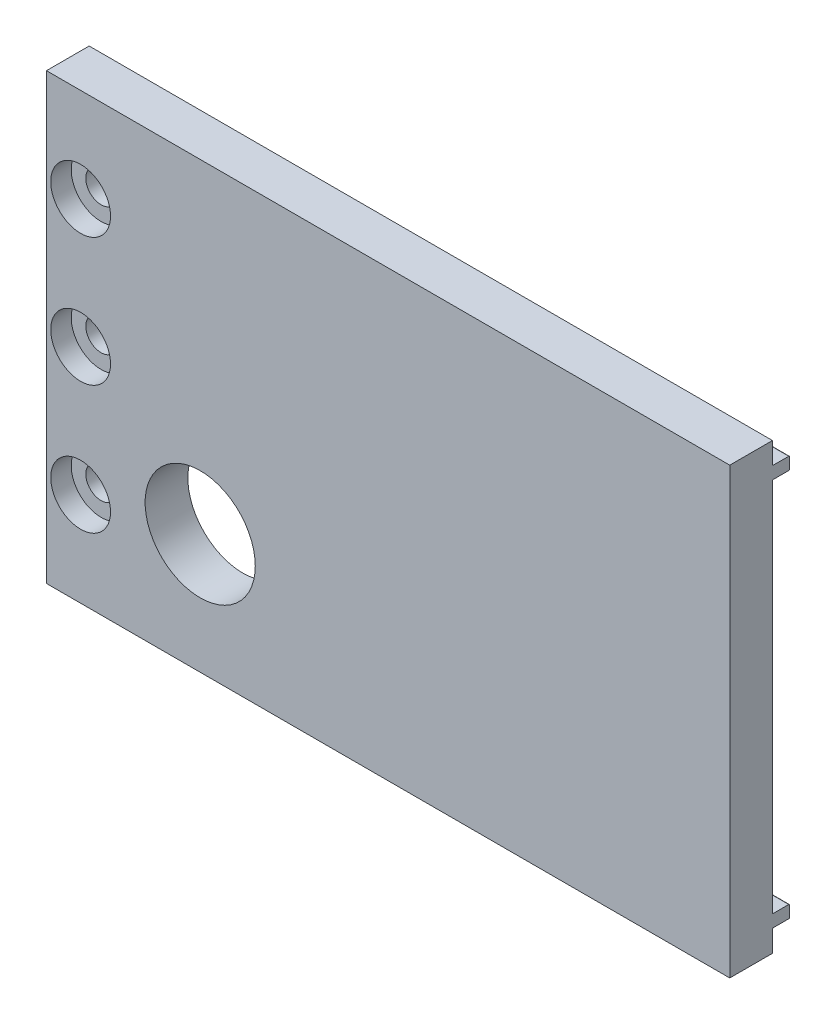
from build123d import *

# Parameters (mm, degrees)
ESQUISSE1_W                                        = 80
ESQUISSE1_H                                        = 52
BOSS_EXTRU_1_DEPTH                                 = 5
ESQUISSE2_R                                        = 6.447859464
ENL_V_MAT_EXTRU_1_DEPTH                            = 5
CHAMBRAGE_POUR_VIS_T_TE_RONDE_BOMB_E_M_D           = 3.6
CHAMBRAGE_POUR_VIS_T_TE_RONDE_BOMB_E_M_CBORE_D     = 7
CHAMBRAGE_POUR_VIS_T_TE_RONDE_BOMB_E_M_CBORE_DEPTH = 2.4
ESQUISSE5_W                                        = 72
ESQUISSE5_H                                        = 1.45
BOSS_EXTRU_2_DEPTH                                 = 2
CONG_1_R                                           = 0.1


with BuildPart() as part:
    # Esquisse1 → Boss.-Extru.1 (new body)
    with BuildSketch(Plane.XY.offset(16.98011664)):
        with Locations((-44.444303066, 24.066569306)):
            Rectangle(ESQUISSE1_W, ESQUISSE1_H)
    extrude(amount=BOSS_EXTRU_1_DEPTH)

    # Esquisse2 → Enlèv. mat.-Extru.1 (cut)
    with BuildSketch(Plane.XY.offset(21.98011664)):
        with Locations((-66.444303066, 12.061734253)):
            Circle(ESQUISSE2_R)
    extrude(amount=-ENL_V_MAT_EXTRU_1_DEPTH, mode=Mode.SUBTRACT)

    # Chambrage pour vis à tête ronde bombée M34 (through all)
    with Locations(Plane.XY.offset(21.98011664)):
        with Locations((-80.444303066, 9.066569306), (-80.444303066, 24.066569306), (-80.444303066, 39.066569306)):
            CounterBoreHole(CHAMBRAGE_POUR_VIS_T_TE_RONDE_BOMB_E_M_D / 2, CHAMBRAGE_POUR_VIS_T_TE_RONDE_BOMB_E_M_CBORE_D / 2, CHAMBRAGE_POUR_VIS_T_TE_RONDE_BOMB_E_M_CBORE_DEPTH)

    # Esquisse5 → Boss.-Extru.2 (add)
    with BuildSketch(Plane(origin=(0, 0, 16.98011664), x_dir=(-1, 0, 0), z_dir=(0, 0, -1))):
        with Locations((40.444303066, 1.341569306)):
            Rectangle(ESQUISSE5_W, ESQUISSE5_H)
        with Locations((40.444303066, 46.791569306)):
            Rectangle(ESQUISSE5_W, ESQUISSE5_H)
    extrude(amount=BOSS_EXTRU_2_DEPTH)

    # Congé1
    cong_1_edges = [part.edges().sort_by_distance(p)[0] for p in [
        (-40.444303066, 0.616569306, 16.98011664),
        (-40.444303066, 2.066569306, 16.98011664),
        (-40.444303066, 0.616569306, 14.98011664),
        (-40.444303066, 2.066569306, 14.98011664),
        (-40.444303066, 46.066569306, 16.98011664),
        (-40.444303066, 47.516569306, 16.98011664),
        (-40.444303066, 46.066569306, 14.98011664),
        (-40.444303066, 47.516569306, 14.98011664),
    ]]
    fillet(cong_1_edges, radius=CONG_1_R)


solid = part.part
